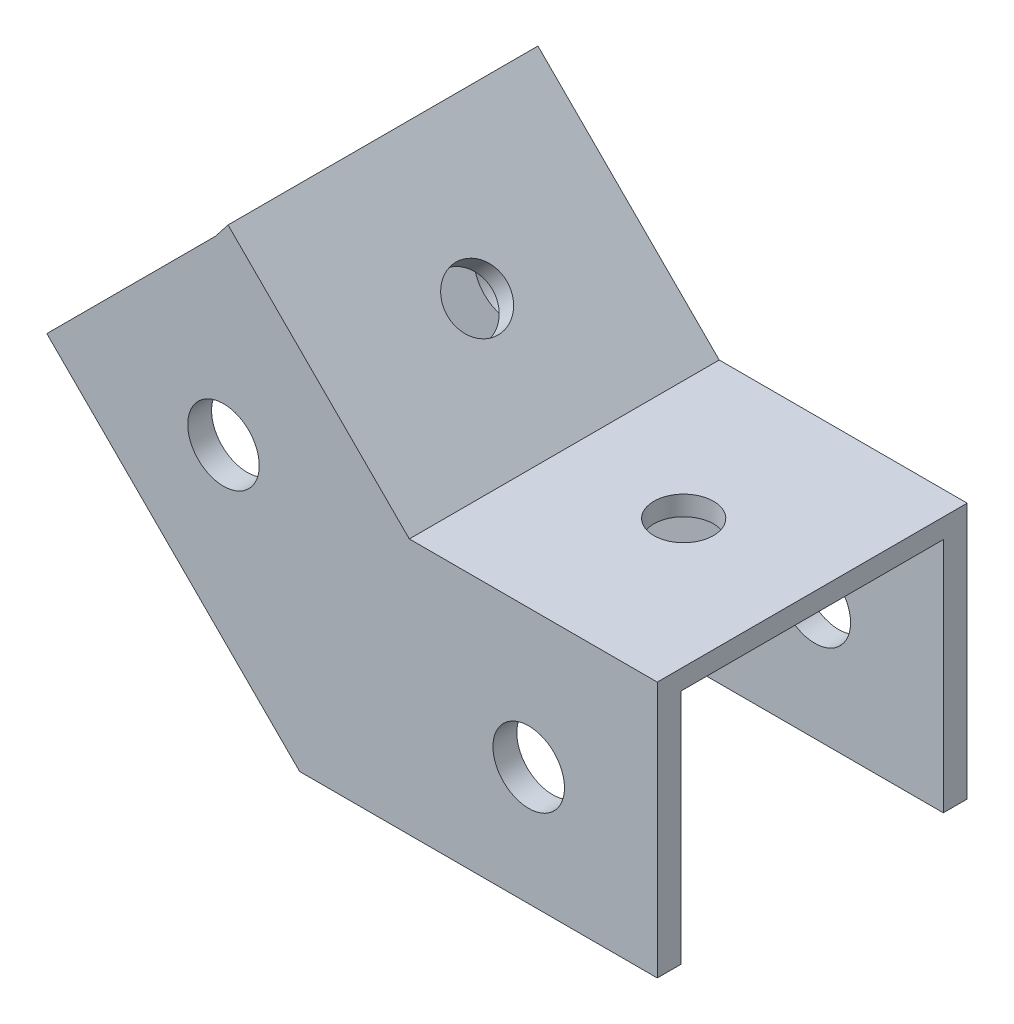
from build123d import *

# Parameters (mm, degrees)
ESBO_O1_R                = 3
RESSALTO_EXTRUS_O1_DEPTH = 2
RESSALTO_EXTRUS_O2_DEPTH = 13
CORTE_EXTRUS_O1_REACH    = 100.627
ESBO_O7_R                = 2.5
CORTE_EXTRUS_O2_REACH    = 98.131
ESBO_O6_R                = 2.5


with BuildPart() as part:
    # Esboço1 → Ressalto-extrusão1 (new body)
    with BuildSketch(Plane.XY):
        Polygon((-42.366282029, -174), (-42.366282029, -154.146561088), (-63.935449693, -154.146561088), (-79.437349841, -138.644660941), (-93.579485465, -152.786796564), (-85.828535391, -160.537746638), (-78.077585317, -168.288696712), (-72.366282029, -174), align=None)
        with Locations((-53.150865861, -164.073280544)):
            Circle(ESBO_O1_R, mode=Mode.SUBTRACT)
        with Locations((-78.757467579, -153.466678826)):
            Circle(ESBO_O1_R, mode=Mode.SUBTRACT)
    ressalto_extrus_o1 = extrude(amount=RESSALTO_EXTRUS_O1_DEPTH)

    # Esboço5 → Ressalto-extrusão2 (add)
    with BuildSketch(Plane.XY.offset(2)):
        Polygon((-78.376689669, -137.290878593), (-79.437349841, -138.644660941), (-63.935449693, -154.146561088), (-42.366282029, -154.146561088), (-42.366282029, -152.5), (-63.167568262, -152.5), align=None)
    ressalto_extrus_o2 = extrude(amount=-RESSALTO_EXTRUS_O2_DEPTH)

    # Espelhar2: Ressalto-extrusão1, Ressalto-extrusão2 across plane
    add(ressalto_extrus_o1.mirror(Plane.XY.offset(-11)))
    add(ressalto_extrus_o2.mirror(Plane.XY.offset(-11)))

    # Esboço7 → Corte-extrusão1 (cut, up to next)
    with BuildSketch(Plane.XZ.offset(154.146561088), mode=Mode.PRIVATE) as corte_extrus_o1_sk1:
        with Locations(Location((-53.150865861, -11, 0), (0, 0, 270))):
            Circle(ESBO_O7_R)
    corte_extrus_o1_tool1 = extrude(corte_extrus_o1_sk1.sketch, amount=-CORTE_EXTRUS_O1_REACH, mode=Mode.PRIVATE) & part.part
    add(corte_extrus_o1_tool1.solids().sort_by_distance((-53.150866, -154.146561, -11))[0], mode=Mode.SUBTRACT)

    # Esboço6 → Corte-extrusão2 (cut, up to next)
    with BuildSketch(Plane(origin=(-109.041005391, -109.041005391, 0), x_dir=(-0.7071067811865478, 0.7071067811865472, 0), z_dir=(-0.7071067811865472, -0.7071067811865478, 0)), mode=Mode.PRIVATE) as corte_extrus_o2_sk1:
        with Locations(Location((-52.82738989, 11, 0), (0, 0, 180))):
            Circle(ESBO_O6_R)
    corte_extrus_o2_tool1 = extrude(corte_extrus_o2_sk1.sketch, amount=-CORTE_EXTRUS_O2_REACH, mode=Mode.PRIVATE) & part.part
    add(corte_extrus_o2_tool1.solids().sort_by_distance((-71.6864, -146.395611, -11))[0], mode=Mode.SUBTRACT)


solid = part.part
